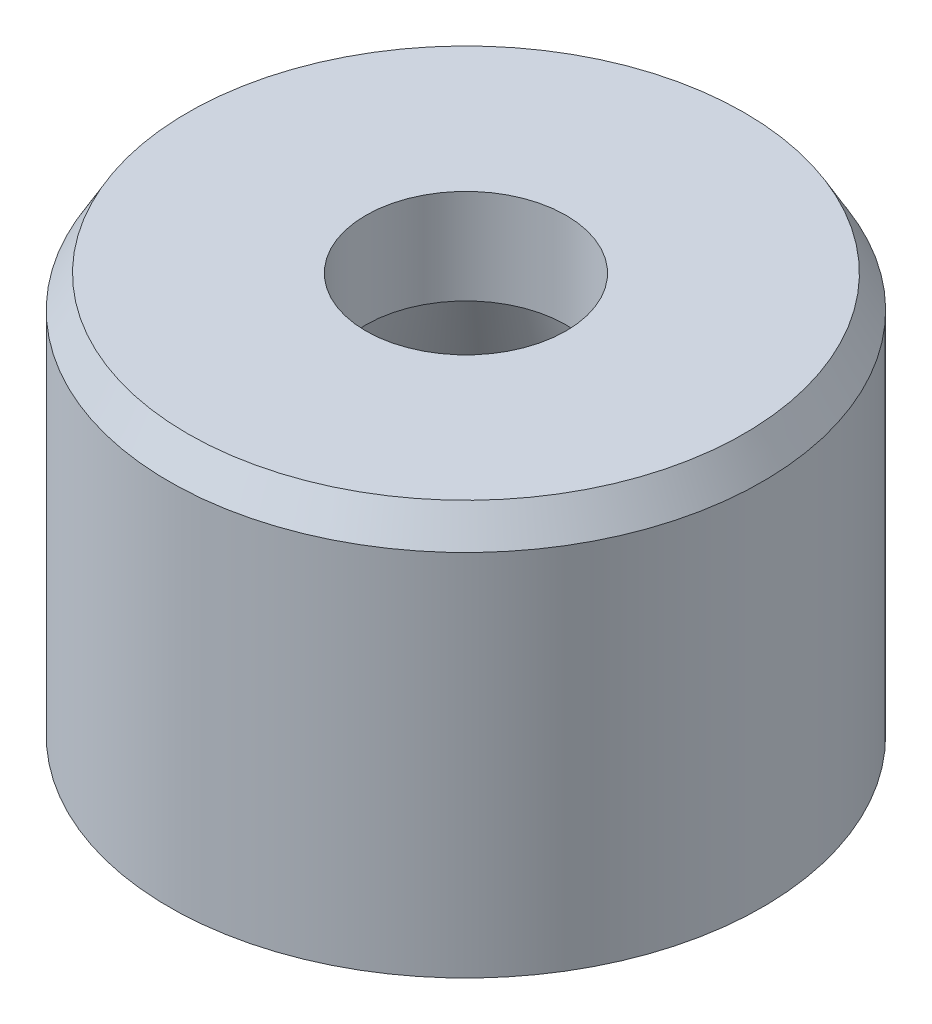
from build123d import *

# Parameters (mm, degrees)
SKETCH1_R           = 8
SKETCH1_R_2         = 2.7
BOSS_EXTRUDE1_DEPTH = 10.8
CHAMFER1_SIZE       = 3
CHAMFER1_SIZE2      = 8.242432258
CHAMFER2_SIZE       = 0.5
CHAMFER2_SIZE2      = 0.866025404


with BuildPart() as part:
    # Sketch1 → Boss-Extrude1 (new body)
    with BuildSketch(Plane(origin=(0, 0, 0), x_dir=(1, 0, 0), z_dir=(0, 1, 0))):
        with Locations(Location((0, 0, 0), (0, 0, 90))):
            Circle(SKETCH1_R)
        with Locations(Location((0, 0, 0), (0, 0, 90))):
            Circle(SKETCH1_R_2, mode=Mode.SUBTRACT)
    extrude(amount=BOSS_EXTRUDE1_DEPTH)

    # Chamfer1
    chamfer1_edges = [part.edges().sort_by_distance(p)[0] for p in [
        (0, 0, 2.7),
    ]]
    chamfer1_side = [part.faces().sort_by_distance(p)[0] for p in [
        (0, 0, 7.77372583),
    ]]
    chamfer(chamfer1_edges, length=CHAMFER1_SIZE, length2=CHAMFER1_SIZE2, reference=chamfer1_side[0])

    # Chamfer2
    chamfer2_edges = [part.edges().sort_by_distance(p)[0] for p in [
        (0, 10.8, 8),
    ]]
    chamfer2_side = [part.faces().sort_by_distance(p)[0] for p in [
        (0, 10.8, 7.77372583),
    ]]
    chamfer(chamfer2_edges, length=CHAMFER2_SIZE, length2=CHAMFER2_SIZE2, reference=chamfer2_side[0])


solid = part.part
